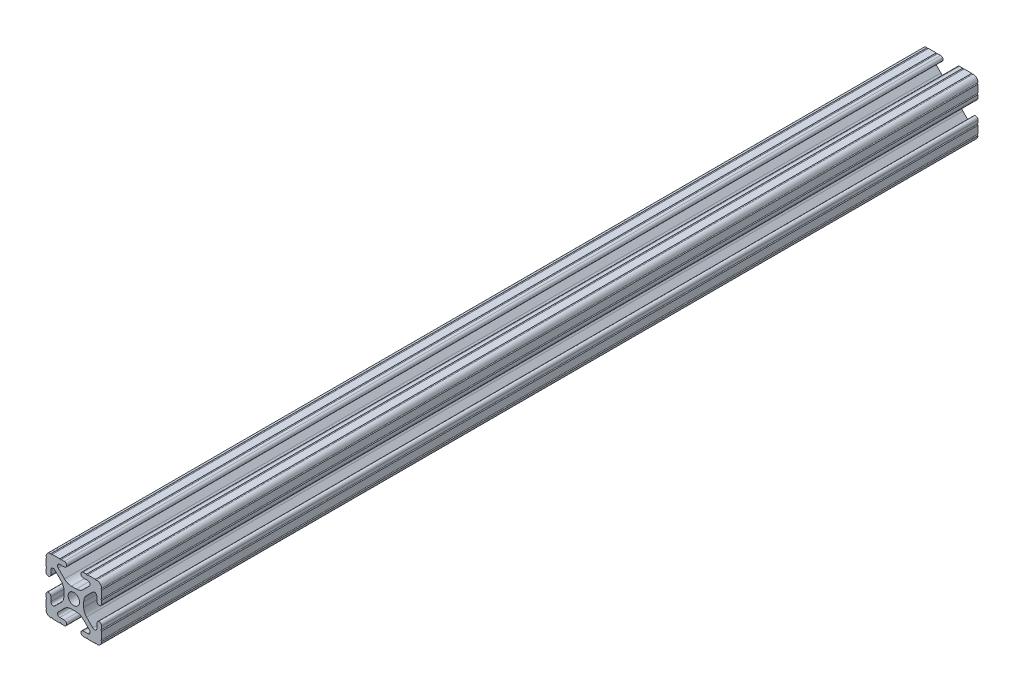
from build123d import *

# Parameters (mm, degrees)
SKETCH3_R      = 2.6035
EXTRUDE1_DEPTH = 200.025


with BuildPart() as part:
    # Sketch3 → Extrude1 (new, symmetric)
    with BuildSketch(Plane.XY):
        with BuildLine():
            Line((-1.115277175, 4.5085), (1.115277175, 4.5085))
            ThreePointArc((1.115277175, 4.5085), (2.806584872, 4.844922018), (4.240406305, 5.80297087))
            Line((4.240406305, 5.80297087), (7.119225992, 8.681790557))
            ThreePointArc((7.119225992, 8.681790557), (7.348862413, 9.836250802), (6.370158275, 10.4902))
            Line((6.370158275, 10.4902), (4.3434, 10.4902))
            ThreePointArc((4.3434, 10.4902), (3.2385, 11.5951), (4.3434, 12.7))
            Line((4.3434, 12.7), (5.738786846, 12.7))
            ThreePointArc((5.738786846, 12.7), (6.054472561, 12.384314286), (6.370158275, 12.7))
            Line((6.370158275, 12.7), (9.858828571, 12.7))
            ThreePointArc((9.858828571, 12.7), (10.174514286, 12.384314286), (10.4902, 12.7))
            ThreePointArc((10.4902, 12.7), (12.052764565, 12.052764565), (12.7, 10.4902))
            ThreePointArc((12.7, 10.4902), (12.384314286, 10.174514286), (12.7, 9.858828571))
            Line((12.7, 9.858828571), (12.7, 6.370158275))
            ThreePointArc((12.7, 6.370158275), (12.384314286, 6.054472561), (12.7, 5.738786846))
            Line((12.7, 5.738786846), (12.7, 4.3434))
            ThreePointArc((12.7, 4.3434), (11.5951, 3.2385), (10.4902, 4.3434))
            Line((10.4902, 4.3434), (10.4902, 6.370158275))
            ThreePointArc((10.4902, 6.370158275), (9.836250802, 7.348862413), (8.681790557, 7.119225992))
            Line((8.681790557, 7.119225992), (5.80297087, 4.240406305))
            ThreePointArc((5.80297087, 4.240406305), (4.844922018, 2.806584872), (4.5085, 1.115277175))
            Line((4.5085, 1.115277175), (4.5085, -1.115277175))
            ThreePointArc((4.5085, -1.115277175), (4.844922018, -2.806584872), (5.80297087, -4.240406305))
            Line((5.80297087, -4.240406305), (8.681790557, -7.119225992))
            ThreePointArc((8.681790557, -7.119225992), (9.836250802, -7.348862413), (10.4902, -6.370158275))
            Line((10.4902, -6.370158275), (10.4902, -4.3434))
            ThreePointArc((10.4902, -4.3434), (11.5951, -3.2385), (12.7, -4.3434))
            Line((12.7, -4.3434), (12.7, -5.738786846))
            ThreePointArc((12.7, -5.738786846), (12.384314286, -6.054472561), (12.7, -6.370158275))
            Line((12.7, -6.370158275), (12.7, -9.858828571))
            ThreePointArc((12.7, -9.858828571), (12.384314286, -10.174514286), (12.7, -10.4902))
            ThreePointArc((12.7, -10.4902), (12.052764565, -12.052764565), (10.4902, -12.7))
            ThreePointArc((10.4902, -12.7), (10.174514286, -12.384314286), (9.858828571, -12.7))
            Line((9.858828571, -12.7), (6.370158275, -12.7))
            ThreePointArc((6.370158275, -12.7), (6.054472561, -12.384314286), (5.738786846, -12.7))
            Line((5.738786846, -12.7), (4.3434, -12.7))
            ThreePointArc((4.3434, -12.7), (3.2385, -11.5951), (4.3434, -10.4902))
            Line((4.3434, -10.4902), (6.370158275, -10.4902))
            ThreePointArc((6.370158275, -10.4902), (7.348862413, -9.836250802), (7.119225992, -8.681790557))
            Line((7.119225992, -8.681790557), (4.240406305, -5.80297087))
            ThreePointArc((4.240406305, -5.80297087), (2.806584872, -4.844922018), (1.115277175, -4.5085))
            Line((1.115277175, -4.5085), (-1.115277175, -4.5085))
            ThreePointArc((-1.115277175, -4.5085), (-2.806584872, -4.844922018), (-4.240406305, -5.80297087))
            Line((-4.240406305, -5.80297087), (-7.119225992, -8.681790557))
            ThreePointArc((-7.119225992, -8.681790557), (-7.348862413, -9.836250802), (-6.370158275, -10.4902))
            Line((-6.370158275, -10.4902), (-4.3434, -10.4902))
            ThreePointArc((-4.3434, -10.4902), (-3.2385, -11.5951), (-4.3434, -12.7))
            Line((-4.3434, -12.7), (-5.738786846, -12.7))
            ThreePointArc((-5.738786846, -12.7), (-6.054472561, -12.384314286), (-6.370158275, -12.7))
            Line((-6.370158275, -12.7), (-9.858828571, -12.7))
            ThreePointArc((-9.858828571, -12.7), (-10.174514286, -12.384314286), (-10.4902, -12.7))
            ThreePointArc((-10.4902, -12.7), (-12.052764565, -12.052764565), (-12.7, -10.4902))
            ThreePointArc((-12.7, -10.4902), (-12.384314286, -10.174514286), (-12.7, -9.858828571))
            Line((-12.7, -9.858828571), (-12.7, -6.370158275))
            ThreePointArc((-12.7, -6.370158275), (-12.384314286, -6.054472561), (-12.7, -5.738786846))
            Line((-12.7, -5.738786846), (-12.7, -4.3434))
            ThreePointArc((-12.7, -4.3434), (-11.5951, -3.2385), (-10.4902, -4.3434))
            Line((-10.4902, -4.3434), (-10.4902, -6.370158275))
            ThreePointArc((-10.4902, -6.370158275), (-9.836250802, -7.348862413), (-8.681790557, -7.119225992))
            Line((-8.681790557, -7.119225992), (-5.80297087, -4.240406305))
            ThreePointArc((-5.80297087, -4.240406305), (-4.844922018, -2.806584872), (-4.5085, -1.115277175))
            Line((-4.5085, -1.115277175), (-4.5085, 1.115277175))
            ThreePointArc((-4.5085, 1.115277175), (-4.844922018, 2.806584872), (-5.80297087, 4.240406305))
            Line((-5.80297087, 4.240406305), (-8.681790557, 7.119225992))
            ThreePointArc((-8.681790557, 7.119225992), (-9.836250802, 7.348862413), (-10.4902, 6.370158275))
            Line((-10.4902, 6.370158275), (-10.4902, 4.3434))
            ThreePointArc((-10.4902, 4.3434), (-11.5951, 3.2385), (-12.7, 4.3434))
            Line((-12.7, 4.3434), (-12.7, 5.738786846))
            ThreePointArc((-12.7, 5.738786846), (-12.384314286, 6.054472561), (-12.7, 6.370158275))
            Line((-12.7, 6.370158275), (-12.7, 9.858828571))
            ThreePointArc((-12.7, 9.858828571), (-12.384314286, 10.174514286), (-12.7, 10.4902))
            ThreePointArc((-12.7, 10.4902), (-12.052764565, 12.052764565), (-10.4902, 12.7))
            ThreePointArc((-10.4902, 12.7), (-10.174514286, 12.384314286), (-9.858828571, 12.7))
            Line((-9.858828571, 12.7), (-6.370158275, 12.7))
            ThreePointArc((-6.370158275, 12.7), (-6.054472561, 12.384314286), (-5.738786846, 12.7))
            Line((-5.738786846, 12.7), (-4.3434, 12.7))
            ThreePointArc((-4.3434, 12.7), (-3.2385, 11.5951), (-4.3434, 10.4902))
            Line((-4.3434, 10.4902), (-6.370158275, 10.4902))
            ThreePointArc((-6.370158275, 10.4902), (-7.348862413, 9.836250802), (-7.119225992, 8.681790557))
            Line((-7.119225992, 8.681790557), (-4.240406305, 5.80297087))
            ThreePointArc((-4.240406305, 5.80297087), (-2.806584872, 4.844922018), (-1.115277175, 4.5085))
        make_face()
        with Locations(Location((0, 0, 0), (0, 0, 180))):
            Circle(SKETCH3_R, mode=Mode.SUBTRACT)
    extrude(amount=EXTRUDE1_DEPTH, both=True)


solid = part.part
